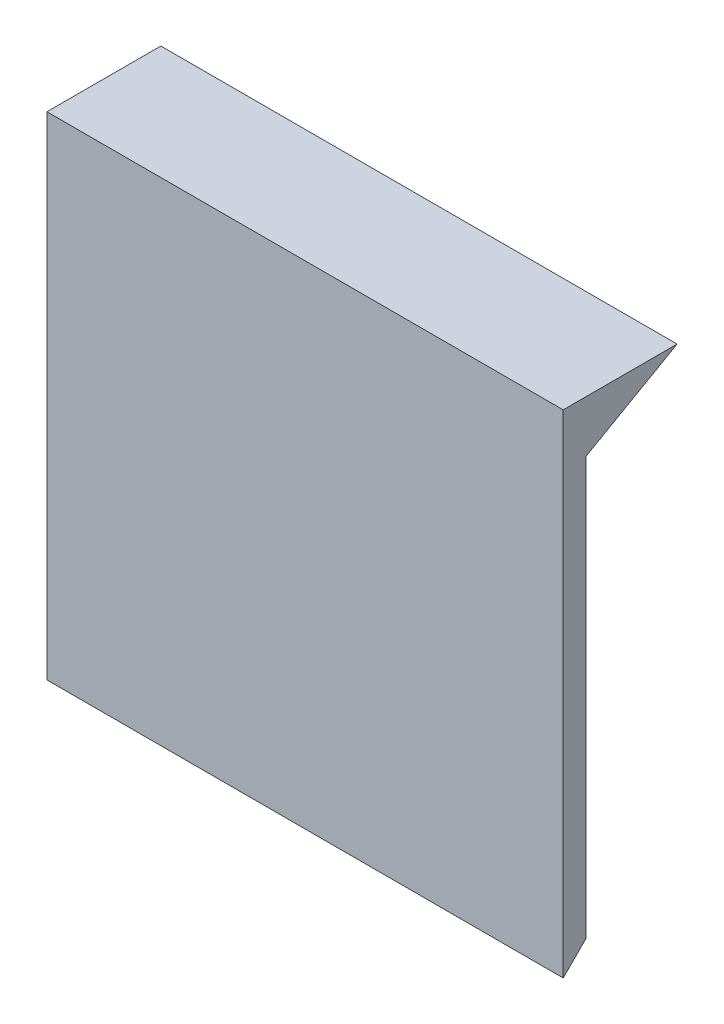
from build123d import *

# Parameters (mm, degrees)
CROQUIS1_W              = 68
CROQUIS1_H              = 55
SALIENTE_EXTRUIR1_DEPTH = 3
SALIENTE_EXTRUIR2_DEPTH = 68
SALIENTE_EXTRUIR3_DEPTH = 68
CROQUIS4_W              = 0.717948718
CROQUIS4_H              = 4
CORTAR_EXTRUIR1_DEPTH   = 1


with BuildPart() as part:
    # Croquis1 → Saliente-Extruir1 (new body)
    with BuildSketch(Plane.XY):
        Rectangle(CROQUIS1_W, CROQUIS1_H)
    extrude(amount=SALIENTE_EXTRUIR1_DEPTH)

    # Croquis2 → Saliente-Extruir2 (add, through all)
    with BuildSketch(Plane.ZY.offset(34)):
        Polygon((3, -27.5), (3, -30.5), (0, -27.5), align=None)
    extrude(amount=-SALIENTE_EXTRUIR2_DEPTH)

    # Croquis3 → Saliente-Extruir3 (add, through all)
    with BuildSketch(Plane(origin=(34, 0, 0), x_dir=(0, 0, -1), z_dir=(1, 0, 0))):
        Polygon((0, 27.5), (12, 34.306550689), (-3, 34.306550689), (-3, 27.5), align=None)
    extrude(amount=-SALIENTE_EXTRUIR3_DEPTH)

    # Croquis4 → Cortar-Extruir1 (cut)
    # profile 1 of 14: a face of its own
    with BuildSketch(Plane(origin=(0, 20.806063436, 11.801460452), x_dir=(1, 0, 0), z_dir=(0, -0.8698184436585139, -0.49337194394440476))):
        with BuildLine():
            Line((-23.153846154, -24.465719693), (-23.955128205, -24.465719693))
            add(Edge.make_bspline(
                [(-23.955128205, -24.465719693), (-24.007482935, -24.465485343), (-24.108486184, -24.465033231), (-24.254141173, -24.459550766), (-24.38851505, -24.449725882), (-24.511576863, -24.437583798), (-24.623276276, -24.420561344), (-24.723752314, -24.401045591), (-24.813028574, -24.377272469), (-24.892102956, -24.349045356), (-24.963091548, -24.315795803), (-25.030190718, -24.280281597), (-25.09239058, -24.238185005), (-25.151151408, -24.192540431), (-25.206028707, -24.14239828), (-25.257429128, -24.087956725), (-25.304823388, -24.028424571), (-25.347914358, -23.964211942), (-25.387025983, -23.896626162), (-25.421190831, -23.825513106), (-25.448904892, -23.750769302), (-25.472153136, -23.672875809), (-25.490826461, -23.591836695), (-25.503255995, -23.507153375), (-25.511698766, -23.419417192), (-25.512443724, -23.359703889), (-25.512820513, -23.329501744)],
                knots=[0, 0, 0, 0, 1.698787518, 3.27731721, 4.728409951, 6.070286353, 7.288646904, 8.393455548, 9.389990496, 10.283725379, 11.113616976, 11.931887102, 12.744353494, 13.547053751, 14.344590688, 15.153907614, 15.974148981, 16.810666655, 17.660988447, 18.506082349, 19.367288142, 20.244738011, 21.142497992, 22.06302001, 23.020302899, 24, 24, 24, 24], degree=3))
            add(Edge.make_bspline(
                [(-25.512820513, -23.329501744), (-25.512277709, -23.296088863), (-25.511211034, -23.230428445), (-25.500675175, -23.134194826), (-25.48285435, -23.042382334), (-25.458997256, -22.954598745), (-25.427879002, -22.871036103), (-25.388877415, -22.792243348), (-25.344264941, -22.71723315), (-25.291598142, -22.647377451), (-25.233401161, -22.582320656), (-25.170736315, -22.521354783), (-25.101723315, -22.466985641), (-25.02882545, -22.416386647), (-24.949956908, -22.372527754), (-24.867454411, -22.331916247), (-24.779225461, -22.297453664), (-24.717827322, -22.279373461), (-24.686698718, -22.270206873)],
                knots=[0, 0, 0, 0, 1.101767505, 2.165108537, 3.187936629, 4.183892551, 5.162396277, 6.123736501, 7.080098904, 8.036826416, 9.0040019, 9.957275584, 10.916231297, 11.898534744, 12.880877694, 13.889532316, 14.930001539, 16, 16, 16, 16], degree=3))
            add(Edge.make_bspline(
                [(-24.686698718, -22.270206873), (-24.666193323, -22.265105097), (-24.621772033, -22.254053008), (-24.548267, -22.242832364), (-24.463560167, -22.232515672), (-24.367377622, -22.223649724), (-24.259663913, -22.217622945), (-24.140523334, -22.212916299), (-24.009901894, -22.209494081), (-23.91907291, -22.209372646), (-23.871794872, -22.209309437)],
                knots=[0, 0, 0, 0, 0.618981996, 1.340914327, 2.176866532, 3.120127938, 4.170906482, 5.338178032, 6.614476169, 8, 8, 8, 8], degree=3))
            Line((-23.871794872, -22.209309437), (-23.871794872, -20.465719693))
            Line((-23.871794872, -20.465719693), (-23.153846154, -20.465719693))
            Line((-23.153846154, -20.465719693), (-23.153846154, -24.465719693))
        make_face()
        with BuildLine():
            Line((-23.871794872, -22.927258155), (-24.125801282, -22.927258155))
            add(Edge.make_bspline(
                [(-24.125801282, -22.927258155), (-24.172022514, -22.927550137), (-24.257070268, -22.92808739), (-24.373204973, -22.935897814), (-24.466563666, -22.947772722), (-24.540237775, -22.964943107), (-24.598432906, -22.990509856), (-24.648021184, -23.021346006), (-24.69207727, -23.05840123), (-24.728801479, -23.102824672), (-24.758728161, -23.152387094), (-24.779718384, -23.207462736), (-24.792966513, -23.267171431), (-24.794224737, -23.308862742), (-24.794871795, -23.330303026)],
                knots=[0, 0, 0, 0, 1.862351722, 3.426754836, 4.68713255, 5.653025869, 6.462861518, 7.236406327, 7.999926698, 8.771672214, 9.54880311, 10.322347919, 11.137246204, 12, 12, 12, 12], degree=3))
            add(Edge.make_bspline(
                [(-24.794871795, -23.330303026), (-24.794244915, -23.349039807), (-24.793028617, -23.385393667), (-24.783970219, -23.437824401), (-24.769911124, -23.486604801), (-24.748424524, -23.53105488), (-24.722337834, -23.572211397), (-24.689243624, -23.608793139), (-24.651079197, -23.64198365), (-24.621565074, -23.659529789), (-24.606570513, -23.668444052)],
                knots=[0, 0, 0, 0, 1.102449765, 2.139017612, 3.12397484, 4.080535277, 5.035673127, 5.982361139, 6.974944601, 8, 8, 8, 8], degree=3))
            add(Edge.make_bspline(
                [(-24.606570513, -23.668444052), (-24.593872463, -23.67486582), (-24.56698809, -23.688462018), (-24.521201396, -23.704268593), (-24.46836425, -23.71760318), (-24.408119942, -23.728670759), (-24.340708803, -23.737260349), (-24.266142862, -23.743829237), (-24.184312388, -23.746470843), (-24.127404189, -23.747325644), (-24.09775641, -23.747770975)],
                knots=[0, 0, 0, 0, 0.656809284, 1.390599849, 2.23162475, 3.173112763, 4.218524733, 5.370385145, 6.63003504, 8, 8, 8, 8], degree=3))
            Line((-24.09775641, -23.747770975), (-23.871794872, -23.747770975))
            Line((-23.871794872, -23.747770975), (-23.871794872, -22.927258155))
        make_face(mode=Mode.SUBTRACT)
    # profile 2 of 14: a face of its own
    with BuildSketch(Plane(origin=(0, 20.806063436, 11.801460452), x_dir=(1, 0, 0), z_dir=(0, -0.8698184436585139, -0.49337194394440476))):
        with BuildLine():
            Line((-20.076923077, -24.465719693), (-20.878205128, -24.465719693))
            add(Edge.make_bspline(
                [(-20.878205128, -24.465719693), (-20.930559858, -24.465485343), (-21.031563107, -24.465033231), (-21.177218096, -24.459550766), (-21.311591973, -24.449725882), (-21.434653786, -24.437583798), (-21.546353199, -24.420561344), (-21.646829238, -24.401045591), (-21.736105497, -24.377272469), (-21.81517988, -24.349045356), (-21.886168471, -24.315795803), (-21.953267642, -24.280281597), (-22.015467503, -24.238185005), (-22.074228331, -24.192540431), (-22.12910563, -24.14239828), (-22.180506051, -24.087956725), (-22.227900311, -24.028424571), (-22.270991281, -23.964211942), (-22.310102906, -23.896626162), (-22.344267754, -23.825513106), (-22.371981815, -23.750769302), (-22.395230059, -23.672875809), (-22.413903384, -23.591836695), (-22.426332918, -23.507153375), (-22.434775689, -23.419417192), (-22.435520647, -23.359703889), (-22.435897436, -23.329501744)],
                knots=[0, 0, 0, 0, 1.698787518, 3.27731721, 4.728409951, 6.070286353, 7.288646904, 8.393455548, 9.389990496, 10.283725379, 11.113616976, 11.931887102, 12.744353494, 13.547053751, 14.344590688, 15.153907614, 15.974148981, 16.810666655, 17.660988447, 18.506082349, 19.367288142, 20.244738011, 21.142497992, 22.06302001, 23.020302899, 24, 24, 24, 24], degree=3))
            add(Edge.make_bspline(
                [(-22.435897436, -23.329501744), (-22.435354632, -23.296088863), (-22.434287957, -23.230428445), (-22.423752098, -23.134194826), (-22.405931273, -23.042382334), (-22.382074179, -22.954598745), (-22.350955926, -22.871036103), (-22.311954338, -22.792243348), (-22.267341864, -22.71723315), (-22.214675065, -22.647377451), (-22.156478084, -22.582320656), (-22.093813238, -22.521354783), (-22.024800239, -22.466985641), (-21.951902373, -22.416386647), (-21.873033831, -22.372527754), (-21.790531334, -22.331916247), (-21.702302384, -22.297453664), (-21.640904246, -22.279373461), (-21.609775641, -22.270206873)],
                knots=[0, 0, 0, 0, 1.101767505, 2.165108537, 3.187936629, 4.183892551, 5.162396277, 6.123736501, 7.080098904, 8.036826416, 9.0040019, 9.957275584, 10.916231297, 11.898534744, 12.880877694, 13.889532316, 14.930001539, 16, 16, 16, 16], degree=3))
            add(Edge.make_bspline(
                [(-21.609775641, -22.270206873), (-21.589270246, -22.265105097), (-21.544848956, -22.254053008), (-21.471343923, -22.242832364), (-21.38663709, -22.232515672), (-21.290454545, -22.223649724), (-21.182740836, -22.217622945), (-21.063600257, -22.212916299), (-20.932978818, -22.209494081), (-20.842149834, -22.209372646), (-20.794871795, -22.209309437)],
                knots=[0, 0, 0, 0, 0.618981996, 1.340914327, 2.176866532, 3.120127938, 4.170906482, 5.338178032, 6.614476169, 8, 8, 8, 8], degree=3))
            Line((-20.794871795, -22.209309437), (-20.794871795, -20.465719693))
            Line((-20.794871795, -20.465719693), (-20.076923077, -20.465719693))
            Line((-20.076923077, -20.465719693), (-20.076923077, -24.465719693))
        make_face()
        with BuildLine():
            Line((-20.794871795, -22.927258155), (-21.048878205, -22.927258155))
            add(Edge.make_bspline(
                [(-21.048878205, -22.927258155), (-21.095099437, -22.927550137), (-21.180147191, -22.92808739), (-21.296281896, -22.935897814), (-21.389640589, -22.947772722), (-21.463314699, -22.964943107), (-21.521509829, -22.990509856), (-21.571098107, -23.021346006), (-21.615154193, -23.05840123), (-21.651878402, -23.102824672), (-21.681805084, -23.152387094), (-21.702795307, -23.207462736), (-21.716043436, -23.267171431), (-21.71730166, -23.308862742), (-21.717948718, -23.330303026)],
                knots=[0, 0, 0, 0, 1.862351722, 3.426754836, 4.68713255, 5.653025869, 6.462861518, 7.236406327, 7.999926698, 8.771672214, 9.54880311, 10.322347919, 11.137246204, 12, 12, 12, 12], degree=3))
            add(Edge.make_bspline(
                [(-21.717948718, -23.330303026), (-21.717321838, -23.349039807), (-21.71610554, -23.385393667), (-21.707047142, -23.437824401), (-21.692988047, -23.486604801), (-21.671501447, -23.53105488), (-21.645414757, -23.572211397), (-21.612320547, -23.608793139), (-21.57415612, -23.64198365), (-21.544641998, -23.659529789), (-21.529647436, -23.668444052)],
                knots=[0, 0, 0, 0, 1.102449765, 2.139017612, 3.12397484, 4.080535277, 5.035673127, 5.982361139, 6.974944601, 8, 8, 8, 8], degree=3))
            add(Edge.make_bspline(
                [(-21.529647436, -23.668444052), (-21.516949386, -23.67486582), (-21.490065013, -23.688462018), (-21.444278319, -23.704268593), (-21.391441173, -23.71760318), (-21.331196865, -23.728670759), (-21.263785726, -23.737260349), (-21.189219785, -23.743829237), (-21.107389311, -23.746470843), (-21.050481112, -23.747325644), (-21.020833333, -23.747770975)],
                knots=[0, 0, 0, 0, 0.656809284, 1.390599849, 2.23162475, 3.173112763, 4.218524733, 5.370385145, 6.63003504, 8, 8, 8, 8], degree=3))
            Line((-21.020833333, -23.747770975), (-20.794871795, -23.747770975))
            Line((-20.794871795, -23.747770975), (-20.794871795, -22.927258155))
        make_face(mode=Mode.SUBTRACT)
    # profile 3 of 14: a face of its own
    with BuildSketch(Plane(origin=(0, 20.806063436, 11.801460452), x_dir=(1, 0, 0), z_dir=(0, -0.8698184436585139, -0.49337194394440476))):
        Polygon((-17.204326923, -24.465719693), (-17.871794872, -24.465719693), (-19.487179487, -20.465719693), (-18.720352564, -20.465719693), (-18.409455128, -21.286232514), (-16.668269231, -21.286232514), (-16.356570513, -20.465719693), (-15.58974359, -20.465719693), align=None)
        Polygon((-17.538461538, -23.392803026), (-16.940705128, -22.004181231), (-18.137019231, -22.004181231), align=None, mode=Mode.SUBTRACT)
    # profile 4 of 14: a face of its own
    with BuildSketch(Plane(origin=(0, 20.806063436, 11.801460452), x_dir=(1, 0, 0), z_dir=(0, -0.8698184436585139, -0.49337194394440476))):
        Polygon((-13.512820513, -24.465719693), (-14.230769231, -24.465719693), (-14.230769231, -21.183668411), (-15.358974359, -21.183668411), (-15.358974359, -20.465719693), (-13.512820513, -20.465719693), align=None)
    # profile 5 of 14: a face of its own
    with BuildSketch(Plane(origin=(0, 20.806063436, 11.801460452), x_dir=(1, 0, 0), z_dir=(0, -0.8698184436585139, -0.49337194394440476))):
        with BuildLine():
            Line((-12.794871795, -23.771809437), (-12.268429487, -23.268604308))
            add(Edge.make_bspline(
                [(-12.268429487, -23.268604308), (-12.223824341, -23.314847154), (-12.136554685, -23.40532096), (-11.995261754, -23.523761022), (-11.850006822, -23.624420209), (-11.700383325, -23.706464603), (-11.546477213, -23.771575694), (-11.388020719, -23.816997162), (-11.225396599, -23.845597208), (-11.115502499, -23.848747012), (-11.060096154, -23.850335078)],
                knots=[0, 0, 0, 0, 1.115370381, 2.182214363, 3.196266025, 4.180416361, 5.141116029, 6.092551847, 7.038303877, 8, 8, 8, 8], degree=3))
            add(Edge.make_bspline(
                [(-11.060096154, -23.850335078), (-11.013831272, -23.849055851), (-10.922532626, -23.846531439), (-10.788494954, -23.827980412), (-10.660232382, -23.796552573), (-10.537643148, -23.752868107), (-10.420121157, -23.697854715), (-10.308760749, -23.628706849), (-10.20296346, -23.547732401), (-10.103965445, -23.455073067), (-10.014591651, -23.353086823), (-9.934064593, -23.245677026), (-9.867364591, -23.130943857), (-9.812917455, -23.010560477), (-9.770011859, -22.884483415), (-9.739560036, -22.752718982), (-9.72191623, -22.614969677), (-9.719285654, -22.521325327), (-9.717948718, -22.473732514)],
                knots=[0, 0, 0, 0, 1.035268443, 2.04298821, 3.02163646, 3.985902049, 4.951223231, 5.920091634, 6.913651787, 7.92868536, 8.949353712, 9.945284791, 10.92850487, 11.913014323, 12.897904816, 13.904240668, 14.934873455, 16, 16, 16, 16], degree=3))
            add(Edge.make_bspline(
                [(-9.717948718, -22.473732514), (-9.718339508, -22.440329527), (-9.719109763, -22.374491555), (-9.727328838, -22.277349147), (-9.740978733, -22.182894235), (-9.760123792, -22.091406674), (-9.784225791, -22.002491809), (-9.813724343, -21.916728789), (-9.849390926, -21.834007577), (-9.889307757, -21.753894858), (-9.933863468, -21.677069463), (-9.983808375, -21.604550175), (-10.038582811, -21.536900499), (-10.095995054, -21.471766463), (-10.15984739, -21.412959807), (-10.227280925, -21.357239615), (-10.299263202, -21.305986272), (-10.375706804, -21.259913042), (-10.454329977, -21.216973591), (-10.536743832, -21.181414194), (-10.620645403, -21.149448414), (-10.707506605, -21.125400529), (-10.795797382, -21.104483953), (-10.886746661, -21.091709549), (-10.979491299, -21.082002692), (-11.042173867, -21.081405059), (-11.073717949, -21.081104308)],
                knots=[0, 0, 0, 0, 1.103833241, 2.175677997, 3.219414644, 4.256521947, 5.263082927, 6.262573145, 7.25136242, 8.238376666, 9.219530388, 10.184343756, 11.145312504, 12.095474572, 13.051075647, 14.010745898, 14.985684176, 15.968306307, 16.959653902, 17.943861036, 18.93268972, 19.924626761, 20.920484516, 21.929288403, 22.957944781, 24, 24, 24, 24], degree=3))
            add(Edge.make_bspline(
                [(-11.073717949, -21.081104308), (-11.127223067, -21.082648424), (-11.23234671, -21.08568221), (-11.386608038, -21.109509557), (-11.53402691, -21.148527802), (-11.651582876, -21.1954591), (-11.743564834, -21.241083026), (-11.813553377, -21.282679757), (-11.885621287, -21.32979713), (-11.959275137, -21.383740372), (-12.034913622, -21.443867531), (-12.111237335, -21.511435342), (-12.190189692, -21.584236222), (-12.24191101, -21.636194901), (-12.268429487, -21.662835078)],
                knots=[0, 0, 0, 0, 1.404640003, 2.759752344, 4.088613405, 5.401587939, 6.076032573, 6.783413463, 7.538272532, 8.336594406, 9.180107851, 10.074881764, 11.012956238, 12, 12, 12, 12], degree=3))
            Line((-12.268429487, -21.662835078), (-12.778846154, -21.126777385))
            add(Edge.make_bspline(
                [(-12.778846154, -21.126777385), (-12.74296661, -21.09213681), (-12.672937413, -21.024525816), (-12.567300307, -20.928524536), (-12.461796177, -20.842256629), (-12.358973658, -20.762591342), (-12.257148849, -20.691848163), (-12.156331032, -20.62996117), (-12.057666781, -20.575348584), (-11.959088761, -20.52898894), (-11.859814452, -20.489373558), (-11.75771467, -20.455963903), (-11.652740631, -20.426799563), (-11.544022937, -20.403848732), (-11.432046675, -20.385165167), (-11.316452025, -20.372819478), (-11.197779083, -20.36425852), (-11.117537194, -20.363526234), (-11.076923077, -20.36315559)],
                knots=[0, 0, 0, 0, 1.244537013, 2.429070097, 3.56066612, 4.644477994, 5.67429546, 6.652817684, 7.595405349, 8.486886006, 9.369351459, 10.26090686, 11.166404474, 12.086719576, 13.0323422, 13.998023148, 14.9867073, 16, 16, 16, 16], degree=3))
            add(Edge.make_bspline(
                [(-11.076923077, -20.36315559), (-11.002322851, -20.36506066), (-10.856350945, -20.368788351), (-10.6424123, -20.396312939), (-10.439007719, -20.442762083), (-10.245771715, -20.507561543), (-10.063295672, -20.591703297), (-9.891007341, -20.693799648), (-9.729193636, -20.8148196), (-9.579246946, -20.952960067), (-9.443655529, -21.105556712), (-9.323672936, -21.269340861), (-9.224859852, -21.445488688), (-9.141022029, -21.630226994), (-9.078198316, -21.826443952), (-9.03246819, -22.032366515), (-9.004641647, -22.248878368), (-9.001567722, -22.396726462), (-9, -22.472129949)],
                knots=[0, 0, 0, 0, 1.07798487, 2.109316747, 3.111276023, 4.08905949, 5.049398091, 6.009992678, 6.978127636, 7.964347882, 8.951383687, 9.924270623, 10.892397886, 11.86520058, 12.851549246, 13.863953586, 14.910602472, 16, 16, 16, 16], degree=3))
            add(Edge.make_bspline(
                [(-9, -22.472129949), (-9.000684697, -22.521305368), (-9.002041598, -22.618759029), (-9.01541839, -22.762688446), (-9.035938972, -22.902411558), (-9.065144578, -23.037756516), (-9.101457873, -23.169191946), (-9.147679446, -23.296122751), (-9.201215896, -23.419243792), (-9.263719124, -23.537407687), (-9.333781906, -23.650763756), (-9.410379474, -23.759025475), (-9.494986848, -23.861116012), (-9.586800021, -23.957481883), (-9.685055938, -24.04874593), (-9.790715536, -24.134260444), (-9.903879844, -24.213473962), (-10.02339455, -24.286451587), (-10.146984356, -24.353471461), (-10.274737095, -24.40966746), (-10.404163114, -24.459274898), (-10.536139345, -24.49934391), (-10.670956272, -24.529568065), (-10.807584402, -24.552376184), (-10.94714008, -24.565141384), (-11.040841286, -24.567229652), (-11.088141026, -24.568283796)],
                knots=[0, 0, 0, 0, 1.07193642, 2.124315995, 3.14887099, 4.149444713, 5.141371803, 6.119544533, 7.092241254, 8.06650569, 9.031360777, 9.996057679, 10.955696533, 11.919602115, 12.89624813, 13.877605408, 14.880920851, 15.905674436, 16.929600311, 17.943674756, 18.946313929, 19.950355855, 20.947755382, 21.956851243, 22.968632213, 24, 24, 24, 24], degree=3))
            add(Edge.make_bspline(
                [(-11.088141026, -24.568283796), (-11.128492248, -24.567678775), (-11.208775152, -24.566475024), (-11.328333165, -24.556458188), (-11.446921919, -24.540682184), (-11.564179284, -24.517045881), (-11.68063256, -24.48842123), (-11.795794186, -24.453163388), (-11.909346602, -24.410157085), (-12.022274218, -24.362583037), (-12.132324859, -24.308422454), (-12.238542112, -24.247800294), (-12.341189163, -24.18230249), (-12.439647223, -24.11080247), (-12.534609772, -24.034350477), (-12.625975489, -23.952949042), (-12.712867649, -23.865121561), (-12.767398891, -23.803070722), (-12.794871795, -23.771809437)],
                knots=[0, 0, 0, 0, 0.996333415, 1.982307736, 2.96084097, 3.949129141, 4.93457382, 5.921430247, 6.92116383, 7.931890485, 8.946633814, 9.948019707, 10.950686436, 11.952094051, 12.951305284, 13.960287133, 14.972390273, 16, 16, 16, 16], degree=3))
        make_face()
    # profile 6 of 14: a face of its own
    with BuildSketch(Plane(origin=(0, 20.806063436, 11.801460452), x_dir=(1, 0, 0), z_dir=(0, -0.8698184436585139, -0.49337194394440476))):
        with BuildLine():
            Line((-4.435897436, -24.465719693), (-5.272435897, -24.465719693))
            add(Edge.make_bspline(
                [(-5.272435897, -24.465719693), (-5.327731327, -24.465526901), (-5.434080014, -24.465156107), (-5.587421137, -24.459154602), (-5.728313889, -24.451021359), (-5.857071289, -24.437847016), (-5.973546596, -24.4227086), (-6.077502286, -24.402386292), (-6.169324984, -24.379842088), (-6.250144221, -24.35210027), (-6.322902174, -24.320203357), (-6.390456379, -24.28409423), (-6.454494684, -24.242790234), (-6.514550784, -24.196423973), (-6.57247278, -24.146756349), (-6.625159583, -24.090900702), (-6.674961574, -24.030685187), (-6.721355673, -23.966105908), (-6.763010931, -23.89731361), (-6.79893023, -23.825130692), (-6.829857827, -23.749995008), (-6.854333909, -23.671632021), (-6.873853726, -23.590264815), (-6.886906802, -23.50609527), (-6.896605204, -23.418935206), (-6.897155292, -23.359712094), (-6.897435897, -23.329501744)],
                knots=[0, 0, 0, 0, 1.748592178, 3.36303531, 4.852592433, 6.210838904, 7.455605234, 8.565530618, 9.559147328, 10.443333557, 11.264119507, 12.069061813, 12.863340979, 13.67089394, 14.467102114, 15.273638367, 16.095597024, 16.937114566, 17.786018611, 18.63597263, 19.484582448, 20.352808207, 21.22970172, 22.128176732, 23.04516274, 24, 24, 24, 24], degree=3))
            add(Edge.make_bspline(
                [(-6.897435897, -23.329501744), (-6.896697318, -23.297970723), (-6.8952491, -23.236144137), (-6.887512878, -23.14531399), (-6.873130334, -23.05820336), (-6.852055763, -22.975371273), (-6.82683074, -22.895969383), (-6.794161904, -22.82123695), (-6.757012409, -22.749851966), (-6.712941058, -22.68299079), (-6.664544444, -22.619216555), (-6.608337513, -22.560845517), (-6.54749618, -22.505110651), (-6.480169006, -22.453909928), (-6.406557561, -22.407562078), (-6.328046034, -22.364184521), (-6.243549399, -22.324547714), (-6.184197218, -22.302377461), (-6.153846154, -22.291040206)],
                knots=[0, 0, 0, 0, 1.099808295, 2.156523617, 3.176426857, 4.17500812, 5.135317955, 6.078349783, 7.015890908, 7.9382699, 8.868004242, 9.803692517, 10.759882289, 11.743580734, 12.748787378, 13.791075452, 14.870417076, 16, 16, 16, 16], degree=3))
            Line((-6.153846154, -22.291040206), (-7.076923077, -20.465719693))
            Line((-7.076923077, -20.465719693), (-6.278846154, -20.465719693))
            Line((-6.278846154, -20.465719693), (-5.397435897, -22.209309437))
            Line((-5.397435897, -22.209309437), (-5.153846154, -22.209309437))
            Line((-5.153846154, -22.209309437), (-5.153846154, -20.465719693))
            Line((-5.153846154, -20.465719693), (-4.435897436, -20.465719693))
            Line((-4.435897436, -20.465719693), (-4.435897436, -24.465719693))
        make_face()
        with BuildLine():
            Line((-5.153846154, -22.927258155), (-5.43349359, -22.927258155))
            add(Edge.make_bspline(
                [(-5.43349359, -22.927258155), (-5.467682819, -22.927643211), (-5.533147846, -22.928380511), (-5.627295067, -22.931800539), (-5.7128035, -22.940040695), (-5.790039031, -22.950452914), (-5.859394532, -22.962471916), (-5.920237897, -22.979707455), (-5.973549427, -22.998142128), (-6.018563674, -23.021161451), (-6.057179759, -23.046879076), (-6.089547925, -23.07738398), (-6.118063116, -23.110800484), (-6.140430679, -23.14923184), (-6.158502228, -23.191103523), (-6.169709619, -23.237203307), (-6.178601622, -23.286696502), (-6.17918408, -23.321175164), (-6.179487179, -23.339117129)],
                knots=[0, 0, 0, 0, 1.688935225, 3.233948049, 4.651771667, 5.929878493, 7.083962697, 8.124219224, 9.050753627, 9.864999381, 10.615157594, 11.334035464, 12.05533055, 12.777108108, 13.522027315, 14.29964284, 15.115170198, 16, 16, 16, 16], degree=3))
            add(Edge.make_bspline(
                [(-6.179487179, -23.339117129), (-6.17871268, -23.360328011), (-6.177200785, -23.401733657), (-6.160852932, -23.461510462), (-6.136186071, -23.517240419), (-6.101265219, -23.568151574), (-6.057699921, -23.612695799), (-6.007775484, -23.651726261), (-5.950534604, -23.682965409), (-5.8976808, -23.704271533), (-5.848802243, -23.716552287), (-5.804984578, -23.725336702), (-5.754147964, -23.732453028), (-5.696364702, -23.73769033), (-5.631740976, -23.742673725), (-5.560123429, -23.745758983), (-5.481576056, -23.747135694), (-5.426816663, -23.747553117), (-5.398237179, -23.747770975)],
                knots=[0, 0, 0, 0, 1.020050218, 1.991234449, 2.965145773, 3.94719294, 4.948794399, 5.958308566, 6.989992871, 8.082620171, 8.694688219, 9.416833949, 10.236190632, 11.167557654, 12.21328564, 13.36031274, 14.622320386, 16, 16, 16, 16], degree=3))
            Line((-5.398237179, -23.747770975), (-5.153846154, -23.747770975))
            Line((-5.153846154, -23.747770975), (-5.153846154, -22.927258155))
        make_face(mode=Mode.SUBTRACT)
    # profile 7 of 14: a face of its own
    with BuildSketch(Plane(origin=(0, 20.806063436, 11.801460452), x_dir=(1, 0, 0), z_dir=(0, -0.8698184436585139, -0.49337194394440476))):
        with BuildLine():
            add(Edge.make_bspline(
                [(-1.649038462, -24.568283796), (-1.718583711, -24.566483877), (-1.855881785, -24.56293043), (-2.057791695, -24.533287341), (-2.252392562, -24.485043768), (-2.439712281, -24.417703509), (-2.619111999, -24.330491835), (-2.791250877, -24.224599902), (-2.955657186, -24.099129175), (-3.110414114, -23.955870125), (-3.252322428, -23.799220837), (-3.377061447, -23.632210129), (-3.482949064, -23.456562315), (-3.568898298, -23.272243174), (-3.636018452, -23.079505886), (-3.682666169, -22.878277307), (-3.712743511, -22.668815121), (-3.716194714, -22.526187863), (-3.717948718, -22.453700462)],
                knots=[0, 0, 0, 0, 1.014151002, 2.002163778, 2.969868608, 3.93493411, 4.9003771, 5.874719092, 6.87846472, 7.912488755, 8.947011879, 9.957751389, 10.948740761, 11.933621513, 12.919426746, 13.920294397, 14.943031967, 16, 16, 16, 16], degree=3))
            add(Edge.make_bspline(
                [(-3.717948718, -22.453700462), (-3.71608019, -22.382029965), (-3.712398195, -22.240800951), (-3.683897695, -22.033267076), (-3.636439226, -21.834201298), (-3.570613069, -21.643535561), (-3.486166675, -21.461266741), (-3.381896167, -21.287986278), (-3.258486606, -21.123338134), (-3.1184589, -20.968331007), (-2.965251603, -20.826715455), (-2.802011998, -20.702394395), (-2.630256665, -20.597828908), (-2.451082976, -20.511037309), (-2.262800631, -20.445815893), (-2.067497101, -20.396997469), (-1.863538616, -20.368767968), (-1.724978103, -20.365045198), (-1.654647436, -20.36315559)],
                knots=[0, 0, 0, 0, 1.051517626, 2.07204922, 3.067438659, 4.05042616, 5.027204762, 6.009981242, 7.012629434, 8.042243656, 9.071350414, 10.070091277, 11.048190212, 12.017682766, 12.985867053, 13.966945899, 14.968060614, 16, 16, 16, 16], degree=3))
            add(Edge.make_bspline(
                [(-1.654647436, -20.36315559), (-1.581084298, -20.36483079), (-1.436542788, -20.368122327), (-1.224953131, -20.399159297), (-1.022520878, -20.446479292), (-0.829800698, -20.514987257), (-0.646942409, -20.604003821), (-0.47312597, -20.711484528), (-0.309658634, -20.839505517), (-0.157085286, -20.984205456), (-0.018869566, -21.142579989), (0.103137127, -21.309877982), (0.206051423, -21.48483426), (0.289878607, -21.667527365), (0.355964522, -21.856822774), (0.402580644, -22.053873122), (0.430117896, -22.258205871), (0.433953675, -22.396992757), (0.435897436, -22.467322257)],
                knots=[0, 0, 0, 0, 1.067953136, 2.098381936, 3.099641766, 4.083805132, 5.062469929, 6.048665414, 7.046702845, 8.073106546, 9.098695993, 10.09591865, 11.076726721, 12.041940862, 13.011263376, 13.984305721, 14.978557872, 16, 16, 16, 16], degree=3))
            add(Edge.make_bspline(
                [(0.435897436, -22.467322257), (0.435278955, -22.514634212), (0.434049825, -22.608659044), (0.419568751, -22.748035213), (0.398091548, -22.884491176), (0.368689771, -23.018283534), (0.329075803, -23.149067497), (0.280928241, -23.277172958), (0.224821156, -23.402599211), (0.160119931, -23.524211951), (0.086929937, -23.640556149), (0.00878277, -23.75264796), (-0.07731477, -23.857544754), (-0.169585593, -23.956385968), (-0.268391115, -24.048719776), (-0.373903418, -24.134861458), (-0.485956426, -24.214591304), (-0.603338137, -24.288568159), (-0.725647016, -24.35336039), (-0.849973105, -24.412089803), (-0.977509918, -24.459707596), (-1.107331453, -24.499146151), (-1.239139238, -24.530797193), (-1.373950945, -24.551842438), (-1.510628793, -24.566437914), (-1.602792414, -24.567667042), (-1.649038462, -24.568283796)],
                knots=[0, 0, 0, 0, 1.034641744, 2.056182551, 3.061960284, 4.05571729, 5.050247014, 6.048716841, 7.047801973, 8.054190544, 9.059424999, 10.053182006, 11.041513076, 12.025412457, 13.009311837, 13.997642908, 15.002928308, 16.016213968, 17.030509951, 18.02913364, 19.022134519, 20.005478534, 20.996155877, 21.984625117, 22.988721131, 24, 24, 24, 24], degree=3))
        make_face()
        with BuildLine():
            add(Edge.make_bspline(
                [(-1.637820513, -23.850335078), (-1.591016805, -23.849079227), (-1.498645015, -23.846600682), (-1.363152383, -23.827717562), (-1.23307482, -23.797558954), (-1.109132699, -23.753875), (-0.990791426, -23.698274915), (-0.877831559, -23.6309597), (-0.771853984, -23.549589738), (-0.671304312, -23.458630825), (-0.580780544, -23.356863029), (-0.499387415, -23.248989737), (-0.433577767, -23.132415336), (-0.376990865, -23.010979471), (-0.335192685, -22.881611158), (-0.30336773, -22.746410035), (-0.286033757, -22.603988165), (-0.283397686, -22.507161986), (-0.282051282, -22.457706873)],
                knots=[0, 0, 0, 0, 1.033668485, 2.040047952, 3.016132939, 3.979056467, 4.937231767, 5.900589077, 6.877725736, 7.88429546, 8.891280164, 9.882584218, 10.863295226, 11.842887319, 12.837417301, 13.860812229, 14.907384602, 16, 16, 16, 16], degree=3))
            add(Edge.make_bspline(
                [(-0.282051282, -22.457706873), (-0.283687902, -22.40288422), (-0.286895406, -22.295440904), (-0.309135471, -22.138621468), (-0.348104398, -21.990691467), (-0.401340649, -21.851156025), (-0.472106812, -21.721482435), (-0.55674474, -21.600098626), (-0.657373582, -21.487757719), (-0.734760992, -21.42211377), (-0.774038462, -21.388796616)],
                knots=[0, 0, 0, 0, 1.078343132, 2.113373867, 3.107373148, 4.082093053, 5.043582658, 6.005574554, 6.987742499, 8, 8, 8, 8], degree=3))
            add(Edge.make_bspline(
                [(-0.774038462, -21.388796616), (-0.80622278, -21.364187085), (-0.869866298, -21.315522481), (-0.97145521, -21.253148806), (-1.076071785, -21.199688345), (-1.184505488, -21.156492925), (-1.29652731, -21.122516134), (-1.412121891, -21.098722746), (-1.531125444, -21.083790337), (-1.611601223, -21.082005631), (-1.65224359, -21.081104308)],
                knots=[0, 0, 0, 0, 1.023928204, 2.024787132, 3.009472467, 3.9914905, 4.972207045, 5.96565515, 6.972602802, 8, 8, 8, 8], degree=3))
            add(Edge.make_bspline(
                [(-1.65224359, -21.081104308), (-1.698241616, -21.082372604), (-1.78874418, -21.084868015), (-1.921727257, -21.103493013), (-2.049069989, -21.135151175), (-2.171952708, -21.178141811), (-2.288729923, -21.23575671), (-2.401222686, -21.304169984), (-2.508090278, -21.385515296), (-2.608029913, -21.47876645), (-2.699619247, -21.580539046), (-2.780650318, -21.688995813), (-2.847757404, -21.804140973), (-2.903733254, -21.924436435), (-2.947344676, -22.050840002), (-2.977190368, -22.183361209), (-2.996371623, -22.321465392), (-2.998775417, -22.415441085), (-3, -22.463315847)],
                knots=[0, 0, 0, 0, 1.026350473, 2.019376834, 2.989435443, 3.95094063, 4.91865229, 5.889827372, 6.885283771, 7.910196595, 8.935871797, 9.9372888, 10.925850568, 11.904605667, 12.894245083, 13.903507864, 14.931967858, 16, 16, 16, 16], degree=3))
            add(Edge.make_bspline(
                [(-3, -22.463315847), (-2.99873779, -22.510917279), (-2.996253322, -22.60461344), (-2.977523949, -22.742334505), (-2.946387004, -22.874127552), (-2.90238055, -23.000332308), (-2.847557665, -23.121611339), (-2.778690994, -23.236912047), (-2.697273257, -23.346134677), (-2.604792839, -23.448629886), (-2.504150145, -23.542822732), (-2.396095792, -23.624563391), (-2.283658432, -23.695593842), (-2.164256851, -23.751236129), (-2.040334254, -23.795566248), (-1.911134368, -23.828211577), (-1.776167863, -23.846468031), (-1.684347359, -23.849034572), (-1.637820513, -23.850335078)],
                knots=[0, 0, 0, 0, 1.055040155, 2.076685641, 3.074845078, 4.052329834, 5.035358467, 6.020382375, 7.023447318, 8.050688466, 9.077178457, 10.074336316, 11.0503314, 12.019748348, 12.988025369, 13.964577102, 14.968620271, 16, 16, 16, 16], degree=3))
        make_face(mode=Mode.SUBTRACT)
    # profile 8 of 14: a face of its own
    with BuildSketch(Plane(origin=(0, 20.806063436, 11.801460452), x_dir=(1, 0, 0), z_dir=(0, -0.8698184436585139, -0.49337194394440476))):
        with BuildLine():
            Line((4.128205128, -24.465719693), (3.223557692, -24.465719693))
            add(Edge.make_bspline(
                [(3.223557692, -24.465719693), (3.153028302, -24.465238059), (3.016694193, -24.464307056), (2.819200963, -24.45341593), (2.635420063, -24.437422802), (2.465767237, -24.41294604), (2.309631551, -24.384536929), (2.168165531, -24.346491096), (2.040217867, -24.302830227), (1.924445755, -24.25195929), (1.819045747, -24.192299458), (1.719674654, -24.125274111), (1.62518529, -24.049877712), (1.535054013, -23.965934745), (1.449061172, -23.874003347), (1.369225377, -23.772232401), (1.292987149, -23.66325791), (1.221583462, -23.546701652), (1.158025262, -23.422793736), (1.101451338, -23.293484385), (1.054315041, -23.158689557), (1.015934995, -23.018595368), (0.985363167, -22.873607638), (0.963967266, -22.723450111), (0.950741474, -22.568257297), (0.949399728, -22.463075679), (0.948717949, -22.409629949)],
                knots=[0, 0, 0, 0, 1.44349102, 2.790284463, 4.047513061, 5.218094321, 6.297837468, 7.293772999, 8.213586047, 9.062895527, 9.878013142, 10.689252941, 11.514048747, 12.349645483, 13.208421871, 14.087867281, 14.994836234, 15.929653487, 16.883274053, 17.843080533, 18.816554169, 19.803369425, 20.81449504, 21.847452076, 22.906230055, 24, 24, 24, 24], degree=3))
            add(Edge.make_bspline(
                [(0.948717949, -22.409629949), (0.950503033, -22.334214448), (0.954017077, -22.185754618), (0.983620619, -21.967892873), (1.031491762, -21.759045499), (1.098830187, -21.560870289), (1.182217231, -21.375045305), (1.28208351, -21.205292942), (1.395560306, -21.051267181), (1.523654594, -20.915523626), (1.662130452, -20.798135859), (1.806598451, -20.698772944), (1.956929344, -20.619016096), (2.089670882, -20.569210049), (2.205098549, -20.537906744), (2.30629288, -20.51972162), (2.421460779, -20.502855661), (2.551036306, -20.488358925), (2.695403712, -20.478431524), (2.854115944, -20.471575954), (3.027211446, -20.466481828), (3.147431793, -20.465980395), (3.209935897, -20.465719693)],
                knots=[0, 0, 0, 0, 1.315347898, 2.589339334, 3.828278609, 5.048487211, 6.235212834, 7.375728391, 8.47833097, 9.56625089, 10.624194351, 11.640157642, 12.619895326, 13.585848527, 14.106971868, 14.704705962, 15.37825295, 16.137840974, 16.978850452, 17.902510282, 18.909488129, 20, 20, 20, 20], degree=3))
            Line((3.209935897, -20.465719693), (4.128205128, -20.465719693))
            Line((4.128205128, -20.465719693), (4.128205128, -24.465719693))
        make_face()
        with BuildLine():
            Line((3.41025641, -23.747770975), (3.41025641, -21.183668411))
            Line((3.41025641, -21.183668411), (3.03525641, -21.183668411))
            add(Edge.make_bspline(
                [(3.03525641, -21.183668411), (2.990644905, -21.183884438), (2.904855123, -21.184299867), (2.78084277, -21.190007813), (2.666396235, -21.199276839), (2.56136561, -21.212987125), (2.465509435, -21.229484108), (2.379177367, -21.249888701), (2.302199249, -21.274702241), (2.233940286, -21.303945248), (2.171621359, -21.337332628), (2.113887915, -21.376318794), (2.058168098, -21.419644786), (2.005491767, -21.468545645), (1.955662642, -21.522384471), (1.908975383, -21.581435891), (1.864804166, -21.645519849), (1.824294144, -21.714977718), (1.787240932, -21.789065297), (1.754505381, -21.867106746), (1.726870582, -21.949527511), (1.705884645, -22.03629111), (1.688007391, -22.126859136), (1.675098643, -22.221813914), (1.668065913, -22.320845222), (1.66713763, -22.388251823), (1.666666667, -22.422450462)],
                knots=[0, 0, 0, 0, 1.502729547, 2.8898115, 4.181010027, 5.369596896, 6.45687185, 7.456390247, 8.355533714, 9.177830239, 9.954819978, 10.733423081, 11.521791071, 12.330436719, 13.151797389, 13.990712567, 14.864234656, 15.771624029, 16.697123225, 17.652960569, 18.620374037, 19.622036587, 20.657870943, 21.729319508, 22.8479736, 24, 24, 24, 24], degree=3))
            add(Edge.make_bspline(
                [(1.666666667, -22.422450462), (1.667619956, -22.474854894), (1.669478795, -22.577039477), (1.687517099, -22.72585368), (1.716582069, -22.865809151), (1.758921697, -22.996546357), (1.810988368, -23.118896452), (1.877192229, -23.231282803), (1.953511387, -23.335547541), (2.013897389, -23.39670137), (2.044070513, -23.427258155)],
                knots=[0, 0, 0, 0, 1.138242922, 2.219485503, 3.251901297, 4.239342788, 5.201071, 6.134757343, 7.067992642, 8, 8, 8, 8], degree=3))
            add(Edge.make_bspline(
                [(2.044070513, -23.427258155), (2.073821592, -23.453297549), (2.134584802, -23.506480064), (2.241265031, -23.570206318), (2.358821119, -23.626196078), (2.489942396, -23.670589714), (2.633361632, -23.705698094), (2.789933037, -23.729911485), (2.958818137, -23.745470753), (3.075817798, -23.746987808), (3.136217949, -23.747770975)],
                knots=[0, 0, 0, 0, 0.813307809, 1.661089106, 2.549956539, 3.493439533, 4.508053171, 5.589449661, 6.755572447, 8, 8, 8, 8], degree=3))
            Line((3.136217949, -23.747770975), (3.41025641, -23.747770975))
        make_face(mode=Mode.SUBTRACT)
    # profile 9 of 14: a face of its own
    with BuildSketch(Plane(origin=(0, 20.806063436, 11.801460452), x_dir=(1, 0, 0), z_dir=(0, -0.8698184436585139, -0.49337194394440476))):
        Polygon((7.000801282, -24.465719693), (6.333333333, -24.465719693), (4.717948718, -20.465719693), (5.484775641, -20.465719693), (5.795673077, -21.286232514), (7.536858974, -21.286232514), (7.848557692, -20.465719693), (8.615384615, -20.465719693), align=None)
        Polygon((6.666666667, -23.392803026), (7.264423077, -22.004181231), (6.068108974, -22.004181231), align=None, mode=Mode.SUBTRACT)
    # profile 10 of 14: a face of its own
    with BuildSketch(Plane(origin=(0, 20.806063436, 11.801460452), x_dir=(1, 0, 0), z_dir=(0, -0.8698184436585139, -0.49337194394440476))):
        Polygon((10.692307692, -24.465719693), (9.974358974, -24.465719693), (9.974358974, -21.183668411), (8.846153846, -21.183668411), (8.846153846, -20.465719693), (10.692307692, -20.465719693), align=None)
    # profile 11 of 14: a face of its own
    with BuildSketch(Plane(origin=(0, 20.806063436, 11.801460452), x_dir=(1, 0, 0), z_dir=(0, -0.8698184436585139, -0.49337194394440476))):
        with Locations((11.974358974, -22.465719693)):
            Rectangle(CROQUIS4_W, CROQUIS4_H)
    # profile 12 of 14: a face of its own
    with BuildSketch(Plane(origin=(0, 20.806063436, 11.801460452), x_dir=(1, 0, 0), z_dir=(0, -0.8698184436585139, -0.49337194394440476))):
        with BuildLine():
            Line((12.948717949, -23.771809437), (13.475160256, -23.268604308))
            add(Edge.make_bspline(
                [(13.475160256, -23.268604308), (13.519765402, -23.314847154), (13.607035058, -23.40532096), (13.748327989, -23.523761022), (13.893582921, -23.624420209), (14.043206419, -23.706464603), (14.19711253, -23.771575694), (14.355569024, -23.816997162), (14.518193145, -23.845597208), (14.628087245, -23.848747012), (14.68349359, -23.850335078)],
                knots=[0, 0, 0, 0, 1.115370381, 2.182214363, 3.196266025, 4.180416361, 5.141116029, 6.092551847, 7.038303877, 8, 8, 8, 8], degree=3))
            add(Edge.make_bspline(
                [(14.68349359, -23.850335078), (14.729758471, -23.849055851), (14.821057118, -23.846531439), (14.955094789, -23.827980412), (15.083357362, -23.796552573), (15.205946596, -23.752868107), (15.323468586, -23.697854715), (15.434828995, -23.628706849), (15.540626284, -23.547732401), (15.639624299, -23.455073067), (15.728998092, -23.353086823), (15.80952515, -23.245677026), (15.876225152, -23.130943857), (15.930672289, -23.010560477), (15.973577884, -22.884483415), (16.004029707, -22.752718982), (16.021673514, -22.614969677), (16.02430409, -22.521325327), (16.025641026, -22.473732514)],
                knots=[0, 0, 0, 0, 1.035268443, 2.04298821, 3.02163646, 3.985902049, 4.951223231, 5.920091634, 6.913651787, 7.92868536, 8.949353712, 9.945284791, 10.92850487, 11.913014323, 12.897904816, 13.904240668, 14.934873455, 16, 16, 16, 16], degree=3))
            add(Edge.make_bspline(
                [(16.025641026, -22.473732514), (16.025250236, -22.440329527), (16.024479981, -22.374491555), (16.016260906, -22.277349147), (16.00261101, -22.182894235), (15.983465952, -22.091406674), (15.959363953, -22.002491809), (15.929865401, -21.916728789), (15.894198818, -21.834007577), (15.854281987, -21.753894858), (15.809726276, -21.677069463), (15.759781369, -21.604550175), (15.705006933, -21.536900499), (15.64759469, -21.471766463), (15.583742354, -21.412959807), (15.516308818, -21.357239615), (15.444326542, -21.305986272), (15.36788294, -21.259913042), (15.289259767, -21.216973591), (15.206845912, -21.181414194), (15.122944341, -21.149448414), (15.036083139, -21.125400529), (14.947792361, -21.104483953), (14.856843082, -21.091709549), (14.764098445, -21.082002692), (14.701415877, -21.081405059), (14.669871795, -21.081104308)],
                knots=[0, 0, 0, 0, 1.103833241, 2.175677997, 3.219414644, 4.256521947, 5.263082927, 6.262573145, 7.25136242, 8.238376666, 9.219530388, 10.184343756, 11.145312504, 12.095474572, 13.051075647, 14.010745898, 14.985684176, 15.968306307, 16.959653902, 17.943861036, 18.93268972, 19.924626761, 20.920484516, 21.929288403, 22.957944781, 24, 24, 24, 24], degree=3))
            add(Edge.make_bspline(
                [(14.669871795, -21.081104308), (14.616366677, -21.082648424), (14.511243033, -21.08568221), (14.356981706, -21.109509557), (14.209562834, -21.148527802), (14.092006867, -21.1954591), (14.00002491, -21.241083026), (13.930036366, -21.282679757), (13.857968456, -21.32979713), (13.784314606, -21.383740372), (13.708676121, -21.443867531), (13.632352408, -21.511435342), (13.553400052, -21.584236222), (13.501678734, -21.636194901), (13.475160256, -21.662835078)],
                knots=[0, 0, 0, 0, 1.404640003, 2.759752344, 4.088613405, 5.401587939, 6.076032573, 6.783413463, 7.538272532, 8.336594406, 9.180107851, 10.074881764, 11.012956238, 12, 12, 12, 12], degree=3))
            Line((13.475160256, -21.662835078), (12.96474359, -21.126777385))
            add(Edge.make_bspline(
                [(12.96474359, -21.126777385), (13.000623134, -21.09213681), (13.07065233, -21.024525816), (13.176289436, -20.928524536), (13.281793567, -20.842256629), (13.384616085, -20.762591342), (13.486440895, -20.691848163), (13.587258712, -20.62996117), (13.685922962, -20.575348584), (13.784500982, -20.52898894), (13.883775292, -20.489373558), (13.985875074, -20.455963903), (14.090849112, -20.426799563), (14.199566807, -20.403848732), (14.311543069, -20.385165167), (14.427137719, -20.372819478), (14.54581066, -20.36425852), (14.62605255, -20.363526234), (14.666666667, -20.36315559)],
                knots=[0, 0, 0, 0, 1.244537013, 2.429070097, 3.56066612, 4.644477994, 5.67429546, 6.652817684, 7.595405349, 8.486886006, 9.369351459, 10.26090686, 11.166404474, 12.086719576, 13.0323422, 13.998023148, 14.9867073, 16, 16, 16, 16], degree=3))
            add(Edge.make_bspline(
                [(14.666666667, -20.36315559), (14.741266893, -20.36506066), (14.887238798, -20.368788351), (15.101177444, -20.396312939), (15.304582025, -20.442762083), (15.497818028, -20.507561543), (15.680294071, -20.591703297), (15.852582403, -20.693799648), (16.014396108, -20.8148196), (16.164342797, -20.952960067), (16.299934215, -21.105556712), (16.419916807, -21.269340861), (16.518729891, -21.445488688), (16.602567715, -21.630226994), (16.665391428, -21.826443952), (16.711121553, -22.032366515), (16.738948097, -22.248878368), (16.742022022, -22.396726462), (16.743589744, -22.472129949)],
                knots=[0, 0, 0, 0, 1.07798487, 2.109316747, 3.111276023, 4.08905949, 5.049398091, 6.009992678, 6.978127636, 7.964347882, 8.951383687, 9.924270623, 10.892397886, 11.86520058, 12.851549246, 13.863953586, 14.910602472, 16, 16, 16, 16], degree=3))
            add(Edge.make_bspline(
                [(16.743589744, -22.472129949), (16.742905047, -22.521305368), (16.741548145, -22.618759029), (16.728171354, -22.762688446), (16.707650772, -22.902411558), (16.678445166, -23.037756516), (16.642131871, -23.169191946), (16.595910298, -23.296122751), (16.542373847, -23.419243792), (16.47987062, -23.537407687), (16.409807837, -23.650763756), (16.333210269, -23.759025475), (16.248602895, -23.861116012), (16.156789723, -23.957481883), (16.058533806, -24.04874593), (15.952874208, -24.134260444), (15.839709899, -24.213473962), (15.720195193, -24.286451587), (15.596605388, -24.353471461), (15.468852649, -24.40966746), (15.33942663, -24.459274898), (15.207450398, -24.49934391), (15.072633471, -24.529568065), (14.936005341, -24.552376184), (14.796449664, -24.565141384), (14.702748458, -24.567229652), (14.655448718, -24.568283796)],
                knots=[0, 0, 0, 0, 1.07193642, 2.124315995, 3.14887099, 4.149444713, 5.141371803, 6.119544533, 7.092241254, 8.06650569, 9.031360777, 9.996057679, 10.955696533, 11.919602115, 12.89624813, 13.877605408, 14.880920851, 15.905674436, 16.929600311, 17.943674756, 18.946313929, 19.950355855, 20.947755382, 21.956851243, 22.968632213, 24, 24, 24, 24], degree=3))
            add(Edge.make_bspline(
                [(14.655448718, -24.568283796), (14.615097496, -24.567678775), (14.534814591, -24.566475024), (14.415256579, -24.556458188), (14.296667824, -24.540682184), (14.179410459, -24.517045881), (14.062957184, -24.48842123), (13.947795557, -24.453163388), (13.834243141, -24.410157085), (13.721315526, -24.362583037), (13.611264885, -24.308422454), (13.505047632, -24.247800294), (13.40240058, -24.18230249), (13.303942521, -24.11080247), (13.208979971, -24.034350477), (13.117614255, -23.952949042), (13.030722095, -23.865121561), (12.976190852, -23.803070722), (12.948717949, -23.771809437)],
                knots=[0, 0, 0, 0, 0.996333415, 1.982307736, 2.96084097, 3.949129141, 4.93457382, 5.921430247, 6.92116383, 7.931890485, 8.946633814, 9.948019707, 10.950686436, 11.952094051, 12.951305284, 13.960287133, 14.972390273, 16, 16, 16, 16], degree=3))
        make_face()
    # profile 13 of 14: a face of its own
    with BuildSketch(Plane(origin=(0, 20.806063436, 11.801460452), x_dir=(1, 0, 0), z_dir=(0, -0.8698184436585139, -0.49337194394440476))):
        with BuildLine():
            Line((17.358974359, -23.931264565), (17.895833333, -23.440078667))
            add(Edge.make_bspline(
                [(17.895833333, -23.440078667), (17.918825645, -23.47252375), (17.962967676, -23.534813784), (18.034589226, -23.618130556), (18.105782888, -23.689672229), (18.178004288, -23.747393345), (18.250010003, -23.793860661), (18.32332983, -23.825911043), (18.397120276, -23.846522836), (18.446722102, -23.849077003), (18.471153846, -23.850335078)],
                knots=[0, 0, 0, 0, 1.299459705, 2.494781419, 3.587730629, 4.594196874, 5.512431013, 6.380462003, 7.202284646, 8, 8, 8, 8], degree=3))
            add(Edge.make_bspline(
                [(18.471153846, -23.850335078), (18.493952411, -23.849559689), (18.537970449, -23.848062617), (18.60042914, -23.832433013), (18.656558825, -23.807176415), (18.704864361, -23.772288453), (18.743725114, -23.730622103), (18.773941671, -23.68626624), (18.791500571, -23.637903744), (18.793755481, -23.604735898), (18.794871795, -23.588315847)],
                knots=[0, 0, 0, 0, 1.184157716, 2.286297433, 3.324836695, 4.370048774, 5.362957217, 6.276446515, 7.146738784, 8, 8, 8, 8], degree=3))
            add(Edge.make_bspline(
                [(18.794871795, -23.588315847), (18.79416517, -23.571666718), (18.792742124, -23.538137687), (18.778997446, -23.488996716), (18.75828029, -23.440980267), (18.738484203, -23.411750369), (18.728365385, -23.396809437)],
                knots=[0, 0, 0, 0, 0.967525499, 1.948461899, 2.951351359, 4, 4, 4, 4], degree=3))
            add(Edge.make_bspline(
                [(18.728365385, -23.396809437), (18.719129188, -23.385230556), (18.697745838, -23.358423497), (18.658211315, -23.315287225), (18.606517549, -23.264647642), (18.544849424, -23.203953161), (18.470892652, -23.135561372), (18.38623512, -23.057492069), (18.288993294, -22.972397208), (18.220865469, -22.912324115), (18.185096154, -22.880783796)],
                knots=[0, 0, 0, 0, 0.473849886, 1.097042329, 1.870584189, 2.789244661, 3.865562256, 5.093556389, 6.47402294, 8, 8, 8, 8], degree=3))
            add(Edge.make_bspline(
                [(18.185096154, -22.880783796), (18.151441055, -22.851671894), (18.087570669, -22.796423552), (17.996810968, -22.717878448), (17.91652898, -22.64753049), (17.847454839, -22.58485289), (17.787524446, -22.532426792), (17.739388383, -22.487026871), (17.700986528, -22.450639175), (17.679178775, -22.4286358), (17.669871795, -22.419245334)],
                knots=[0, 0, 0, 0, 1.543627419, 2.929484142, 4.163674036, 5.24627963, 6.164986907, 6.925413438, 7.541394495, 8, 8, 8, 8], degree=3))
            add(Edge.make_bspline(
                [(17.669871795, -22.419245334), (17.634541281, -22.381040164), (17.566623625, -22.30759641), (17.478527643, -22.193473582), (17.405240303, -22.082927697), (17.348486761, -21.972837123), (17.307326582, -21.860926731), (17.277363432, -21.745599839), (17.259403415, -21.625207501), (17.257415651, -21.543237244), (17.256410256, -21.501777385)],
                knots=[0, 0, 0, 0, 1.206413378, 2.319150186, 3.339784753, 4.27899982, 5.184598145, 6.099639703, 7.038813909, 8, 8, 8, 8], degree=3))
            add(Edge.make_bspline(
                [(17.256410256, -21.501777385), (17.25712675, -21.461379505), (17.258532539, -21.382117361), (17.275732101, -21.266123637), (17.300292724, -21.155133199), (17.33813775, -21.050257946), (17.384652266, -20.950255021), (17.441342245, -20.855090795), (17.510651409, -20.766986973), (17.587633688, -20.683566271), (17.674115159, -20.608687495), (17.767110587, -20.542672193), (17.866797071, -20.48693382), (17.972414928, -20.440999656), (18.085288777, -20.406911435), (18.203635483, -20.381138754), (18.328647435, -20.365599046), (18.413951516, -20.363981811), (18.457532051, -20.36315559)],
                knots=[0, 0, 0, 0, 1.043039441, 2.046482205, 3.024244422, 3.976033659, 4.920890471, 5.871402525, 6.830893638, 7.812473116, 8.800703348, 9.781190227, 10.754606487, 11.746997808, 12.751247331, 13.796362838, 14.874195872, 16, 16, 16, 16], degree=3))
            add(Edge.make_bspline(
                [(18.457532051, -20.36315559), (18.491742903, -20.363761852), (18.559500008, -20.364962597), (18.659359022, -20.374785823), (18.755802258, -20.390589495), (18.848637091, -20.413415368), (18.938450757, -20.441677656), (19.02426858, -20.478428729), (19.10723156, -20.519989333), (19.187063798, -20.568151343), (19.263103766, -20.624086844), (19.337542314, -20.685588095), (19.407740524, -20.756028176), (19.476380478, -20.83283917), (19.540595431, -20.918247243), (19.603769167, -21.009682386), (19.662818356, -21.109330414), (19.699309733, -21.17922024), (19.717948718, -21.214918411)],
                knots=[0, 0, 0, 0, 1.017088714, 2.014418954, 2.980620591, 3.920647918, 4.854987948, 5.776890852, 6.693269322, 7.612671471, 8.545186947, 9.498010697, 10.480815007, 11.499174288, 12.558697099, 13.655746277, 14.802607237, 16, 16, 16, 16], degree=3))
            Line((19.717948718, -21.214918411), (19.086538462, -21.593924821))
            add(Edge.make_bspline(
                [(19.086538462, -21.593924821), (19.063225535, -21.553401377), (19.018532663, -21.475714471), (18.942796412, -21.371332266), (18.86520849, -21.281946186), (18.783975133, -21.209136136), (18.700084108, -21.151928551), (18.613130202, -21.111044042), (18.523052323, -21.085736577), (18.461695365, -21.082645951), (18.431089744, -21.081104308)],
                knots=[0, 0, 0, 0, 1.283663364, 2.460892379, 3.537111102, 4.529833553, 5.449777664, 6.316464042, 7.160231139, 8, 8, 8, 8], degree=3))
            add(Edge.make_bspline(
                [(18.431089744, -21.081104308), (18.399953712, -21.082351334), (18.339545277, -21.084770746), (18.253178019, -21.107559151), (18.173646208, -21.142536348), (18.105269049, -21.193405302), (18.047203696, -21.251410707), (18.005576805, -21.316831668), (17.978574895, -21.386765866), (17.975769784, -21.435566697), (17.974358974, -21.460110719)],
                knots=[0, 0, 0, 0, 1.13537643, 2.202795631, 3.242191317, 4.290390765, 5.297919085, 6.223733717, 7.106639842, 8, 8, 8, 8], degree=3))
            add(Edge.make_bspline(
                [(17.974358974, -21.460110719), (17.975679533, -21.482933476), (17.978362121, -21.529295724), (17.998013703, -21.598268949), (18.028992914, -21.666907726), (18.064545199, -21.723802962), (18.10161037, -21.771227506), (18.137941338, -21.811700864), (18.180999819, -21.85735241), (18.231882967, -21.906937277), (18.289601113, -21.961408824), (18.354343214, -22.020637541), (18.426806482, -22.084140625), (18.478025721, -22.127396531), (18.504807692, -22.150014565)],
                knots=[0, 0, 0, 0, 0.916057066, 1.860882232, 2.859899639, 3.934694552, 4.546382938, 5.276161949, 6.118633209, 7.067046139, 8.129668089, 9.306861125, 10.591787583, 12, 12, 12, 12], degree=3))
            add(Edge.make_bspline(
                [(18.504807692, -22.150014565), (18.55571938, -22.193093562), (18.653434317, -22.275775197), (18.791542578, -22.397869189), (18.915903847, -22.51206219), (19.025688728, -22.619267756), (19.121223338, -22.718800908), (19.203559378, -22.809787843), (19.271366342, -22.894012801), (19.341678002, -22.994609542), (19.410374555, -23.115464626), (19.468756848, -23.261550333), (19.506488356, -23.407453132), (19.510731881, -23.50556887), (19.512820513, -23.553860719)],
                knots=[0, 0, 0, 0, 1.345685333, 2.582777463, 3.719355561, 4.752181389, 5.678433858, 6.502864483, 7.227563063, 7.858499643, 8.978226409, 10.023061349, 11.026965269, 12, 12, 12, 12], degree=3))
            add(Edge.make_bspline(
                [(19.512820513, -23.553860719), (19.511951446, -23.588105899), (19.510239292, -23.655572583), (19.49501183, -23.754784144), (19.472147969, -23.850469719), (19.439291187, -23.942605096), (19.395221243, -24.030152326), (19.343166566, -24.114528377), (19.281644917, -24.195475357), (19.211134572, -24.271197623), (19.133733621, -24.340805428), (19.051177981, -24.401875255), (18.964230394, -24.453515708), (18.872627195, -24.495584975), (18.776530476, -24.52841369), (18.675851479, -24.551614275), (18.570898733, -24.565449696), (18.499507767, -24.567327326), (18.463141026, -24.568283796)],
                knots=[0, 0, 0, 0, 1.010806554, 1.991397492, 2.957573065, 3.913225829, 4.872777376, 5.846906201, 6.837692339, 7.870332167, 8.898170327, 9.907899016, 10.8981826, 11.879407896, 12.8797257, 13.891947133, 14.926152479, 16, 16, 16, 16], degree=3))
            add(Edge.make_bspline(
                [(18.463141026, -24.568283796), (18.416014321, -24.566555105), (18.322132914, -24.563111371), (18.183285462, -24.536322941), (18.047598304, -24.49375086), (17.937920448, -24.443602863), (17.851402612, -24.393475764), (17.784933583, -24.34826142), (17.716770305, -24.296339839), (17.648164138, -24.236200065), (17.576513519, -24.171318552), (17.505437572, -24.097242718), (17.4314558, -24.017767997), (17.383558093, -23.960604177), (17.358974359, -23.931264565)],
                knots=[0, 0, 0, 0, 1.282890948, 2.555655204, 3.837225328, 5.149160694, 5.83044799, 6.558852598, 7.337307105, 8.162686284, 9.043076448, 9.969084596, 10.957622644, 12, 12, 12, 12], degree=3))
        make_face()
    # profile 14 of 14: a face of its own
    with BuildSketch(Plane(origin=(0, 20.806063436, 11.801460452), x_dir=(1, 0, 0), z_dir=(0, -0.8698184436585139, -0.49337194394440476))):
        with BuildLine():
            add(Edge.make_bspline(
                [(22.197115385, -24.568283796), (22.127570135, -24.566483877), (21.990272062, -24.56293043), (21.788362151, -24.533287341), (21.593761284, -24.485043768), (21.406441565, -24.417703509), (21.227041847, -24.330491835), (21.054902969, -24.224599902), (20.89049666, -24.099129175), (20.735739732, -23.955870125), (20.593831419, -23.799220837), (20.469092399, -23.632210129), (20.363204782, -23.456562315), (20.277255548, -23.272243174), (20.210135394, -23.079505886), (20.163487677, -22.878277307), (20.133410335, -22.668815121), (20.129959132, -22.526187863), (20.128205128, -22.453700462)],
                knots=[0, 0, 0, 0, 1.014151002, 2.002163778, 2.969868608, 3.93493411, 4.9003771, 5.874719092, 6.87846472, 7.912488755, 8.947011879, 9.957751389, 10.948740761, 11.933621513, 12.919426746, 13.920294397, 14.943031967, 16, 16, 16, 16], degree=3))
            add(Edge.make_bspline(
                [(20.128205128, -22.453700462), (20.130073656, -22.382029965), (20.133755651, -22.240800951), (20.162256151, -22.033267076), (20.20971462, -21.834201298), (20.275540777, -21.643535561), (20.359987171, -21.461266741), (20.464257679, -21.287986278), (20.58766724, -21.123338134), (20.727694946, -20.968331007), (20.880902243, -20.826715455), (21.044141848, -20.702394395), (21.215897181, -20.597828908), (21.39507087, -20.511037309), (21.583353215, -20.445815893), (21.778656745, -20.396997469), (21.98261523, -20.368767968), (22.121175743, -20.365045198), (22.19150641, -20.36315559)],
                knots=[0, 0, 0, 0, 1.051517626, 2.07204922, 3.067438659, 4.05042616, 5.027204762, 6.009981242, 7.012629434, 8.042243656, 9.071350414, 10.070091277, 11.048190212, 12.017682766, 12.985867053, 13.966945899, 14.968060614, 16, 16, 16, 16], degree=3))
            add(Edge.make_bspline(
                [(22.19150641, -20.36315559), (22.265069548, -20.36483079), (22.409611058, -20.368122327), (22.621200715, -20.399159297), (22.823632968, -20.446479292), (23.016353148, -20.514987257), (23.199211437, -20.604003821), (23.373027876, -20.711484528), (23.536495212, -20.839505517), (23.68906856, -20.984205456), (23.82728428, -21.142579989), (23.949290973, -21.309877982), (24.052205269, -21.48483426), (24.136032453, -21.667527365), (24.202118369, -21.856822774), (24.24873449, -22.053873122), (24.276271742, -22.258205871), (24.280107522, -22.396992757), (24.282051282, -22.467322257)],
                knots=[0, 0, 0, 0, 1.067953136, 2.098381936, 3.099641766, 4.083805132, 5.062469929, 6.048665414, 7.046702845, 8.073106546, 9.098695993, 10.09591865, 11.076726721, 12.041940862, 13.011263376, 13.984305721, 14.978557872, 16, 16, 16, 16], degree=3))
            add(Edge.make_bspline(
                [(24.282051282, -22.467322257), (24.281432801, -22.514634212), (24.280203671, -22.608659044), (24.265722597, -22.748035213), (24.244245394, -22.884491176), (24.214843617, -23.018283534), (24.175229649, -23.149067497), (24.127082087, -23.277172958), (24.070975002, -23.402599211), (24.006273777, -23.524211951), (23.933083783, -23.640556149), (23.854936616, -23.75264796), (23.768839076, -23.857544754), (23.676568253, -23.956385968), (23.577762731, -24.048719776), (23.472250428, -24.134861458), (23.36019742, -24.214591304), (23.242815709, -24.288568159), (23.12050683, -24.35336039), (22.996180742, -24.412089803), (22.868643928, -24.459707596), (22.738822393, -24.499146151), (22.607014608, -24.530797193), (22.472202902, -24.551842438), (22.335525053, -24.566437914), (22.243361432, -24.567667042), (22.197115385, -24.568283796)],
                knots=[0, 0, 0, 0, 1.034641744, 2.056182551, 3.061960284, 4.05571729, 5.050247014, 6.048716841, 7.047801973, 8.054190544, 9.059424999, 10.053182006, 11.041513076, 12.025412457, 13.009311837, 13.997642908, 15.002928308, 16.016213968, 17.030509951, 18.02913364, 19.022134519, 20.005478534, 20.996155877, 21.984625117, 22.988721131, 24, 24, 24, 24], degree=3))
        make_face()
        with BuildLine():
            add(Edge.make_bspline(
                [(22.208333333, -23.850335078), (22.255137041, -23.849079227), (22.347508831, -23.846600682), (22.483001463, -23.827717562), (22.613079027, -23.797558954), (22.737021147, -23.753875), (22.85536242, -23.698274915), (22.968322287, -23.6309597), (23.074299862, -23.549589738), (23.174849534, -23.458630825), (23.265373302, -23.356863029), (23.346766431, -23.248989737), (23.412576079, -23.132415336), (23.469162981, -23.010979471), (23.510961161, -22.881611158), (23.542786116, -22.746410035), (23.560120089, -22.603988165), (23.56275616, -22.507161986), (23.564102564, -22.457706873)],
                knots=[0, 0, 0, 0, 1.033668485, 2.040047952, 3.016132939, 3.979056467, 4.937231767, 5.900589077, 6.877725736, 7.88429546, 8.891280164, 9.882584218, 10.863295226, 11.842887319, 12.837417301, 13.860812229, 14.907384602, 16, 16, 16, 16], degree=3))
            add(Edge.make_bspline(
                [(23.564102564, -22.457706873), (23.562465944, -22.40288422), (23.55925844, -22.295440904), (23.537018376, -22.138621468), (23.498049448, -21.990691467), (23.444813197, -21.851156025), (23.374047034, -21.721482435), (23.289409106, -21.600098626), (23.188780264, -21.487757719), (23.111392855, -21.42211377), (23.072115385, -21.388796616)],
                knots=[0, 0, 0, 0, 1.078343132, 2.113373867, 3.107373148, 4.082093053, 5.043582658, 6.005574554, 6.987742499, 8, 8, 8, 8], degree=3))
            add(Edge.make_bspline(
                [(23.072115385, -21.388796616), (23.039931066, -21.364187085), (22.976287548, -21.315522481), (22.874698636, -21.253148806), (22.770082061, -21.199688345), (22.661648359, -21.156492925), (22.549626536, -21.122516134), (22.434031955, -21.098722746), (22.315028403, -21.083790337), (22.234552623, -21.082005631), (22.193910256, -21.081104308)],
                knots=[0, 0, 0, 0, 1.023928204, 2.024787132, 3.009472467, 3.9914905, 4.972207045, 5.96565515, 6.972602802, 8, 8, 8, 8], degree=3))
            add(Edge.make_bspline(
                [(22.193910256, -21.081104308), (22.14791223, -21.082372604), (22.057409666, -21.084868015), (21.924426589, -21.103493013), (21.797083857, -21.135151175), (21.674201138, -21.178141811), (21.557423923, -21.23575671), (21.44493116, -21.304169984), (21.338063569, -21.385515296), (21.238123933, -21.47876645), (21.146534599, -21.580539046), (21.065503528, -21.688995813), (20.998396443, -21.804140973), (20.942420592, -21.924436435), (20.898809171, -22.050840002), (20.868963478, -22.183361209), (20.849782223, -22.321465392), (20.847378429, -22.415441085), (20.846153846, -22.463315847)],
                knots=[0, 0, 0, 0, 1.026350473, 2.019376834, 2.989435443, 3.95094063, 4.91865229, 5.889827372, 6.885283771, 7.910196595, 8.935871797, 9.9372888, 10.925850568, 11.904605667, 12.894245083, 13.903507864, 14.931967858, 16, 16, 16, 16], degree=3))
            add(Edge.make_bspline(
                [(20.846153846, -22.463315847), (20.847416056, -22.510917279), (20.849900524, -22.60461344), (20.868629897, -22.742334505), (20.899766842, -22.874127552), (20.943773296, -23.000332308), (20.998596182, -23.121611339), (21.067462853, -23.236912047), (21.148880589, -23.346134677), (21.241361008, -23.448629886), (21.342003701, -23.542822732), (21.450058054, -23.624563391), (21.562495414, -23.695593842), (21.681896996, -23.751236129), (21.805819592, -23.795566248), (21.935019479, -23.828211577), (22.069985983, -23.846468031), (22.161806488, -23.849034572), (22.208333333, -23.850335078)],
                knots=[0, 0, 0, 0, 1.055040155, 2.076685641, 3.074845078, 4.052329834, 5.035358467, 6.020382375, 7.023447318, 8.050688466, 9.077178457, 10.074336316, 11.0503314, 12.019748348, 12.988025369, 13.964577102, 14.968620271, 16, 16, 16, 16], degree=3))
        make_face(mode=Mode.SUBTRACT)
    extrude(amount=-CORTAR_EXTRUIR1_DEPTH, mode=Mode.SUBTRACT)


solid = part.part
